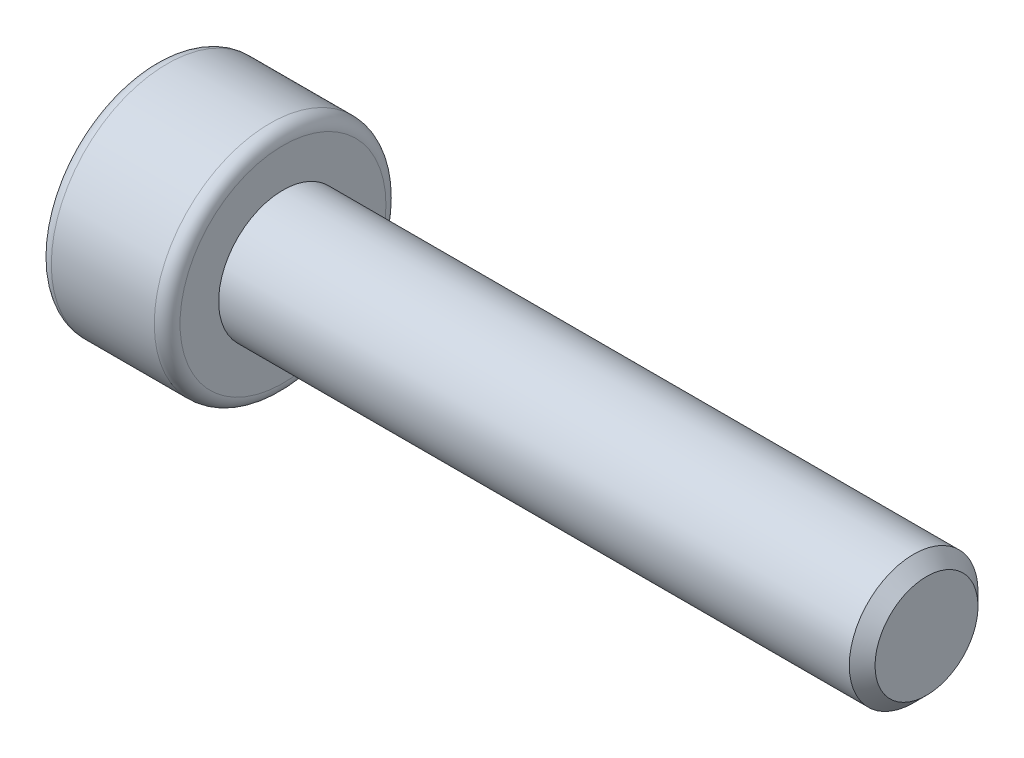
from build123d import *

# Parameters (mm, degrees)
CUT_EXTRUDE_1_DEPTH = 1.5
FILLET_1_R          = 0.2
CHAMFER_1_SIZE      = 0.2


with BuildPart() as part:
    # 草图1 → 旋转1 (revolve)
    with BuildSketch(Plane.XY, mode=Mode.PRIVATE) as revolve_1_sk:
        Polygon((-6, 0), (-6, 1.8), (-4, 1.8), (-4, 1), (6, 1), (6, 0), align=None)
    revolve(revolve_1_sk.sketch.rotate(Axis((6, 0, 0), (-1, 0, 0)), 90), axis=Axis((6, 0, 0), (-1, 0, 0)))

    # 草图2 → 切除-拉伸1 (cut)
    with BuildSketch(Plane.ZY.offset(6)):
        Polygon((0.866025404, 0), (0.433012702, 0.75), (-0.433012702, 0.75), (-0.866025404, 0), (-0.433012702, -0.75), (0.433012702, -0.75), align=None)
    extrude(amount=-CUT_EXTRUDE_1_DEPTH, mode=Mode.SUBTRACT)

    # 圆角1
    fillet_1_edges = [part.edges().sort_by_distance(p)[0] for p in [
        (-4, 0, 1.8),
        (-6, 0, 1.8),
    ]]
    fillet(fillet_1_edges, radius=FILLET_1_R)

    # 倒角1
    chamfer_1_edges = [part.edges().sort_by_distance(p)[0] for p in [
        (6, 0, 1),
    ]]
    chamfer(chamfer_1_edges, length=CHAMFER_1_SIZE)


solid = part.part
